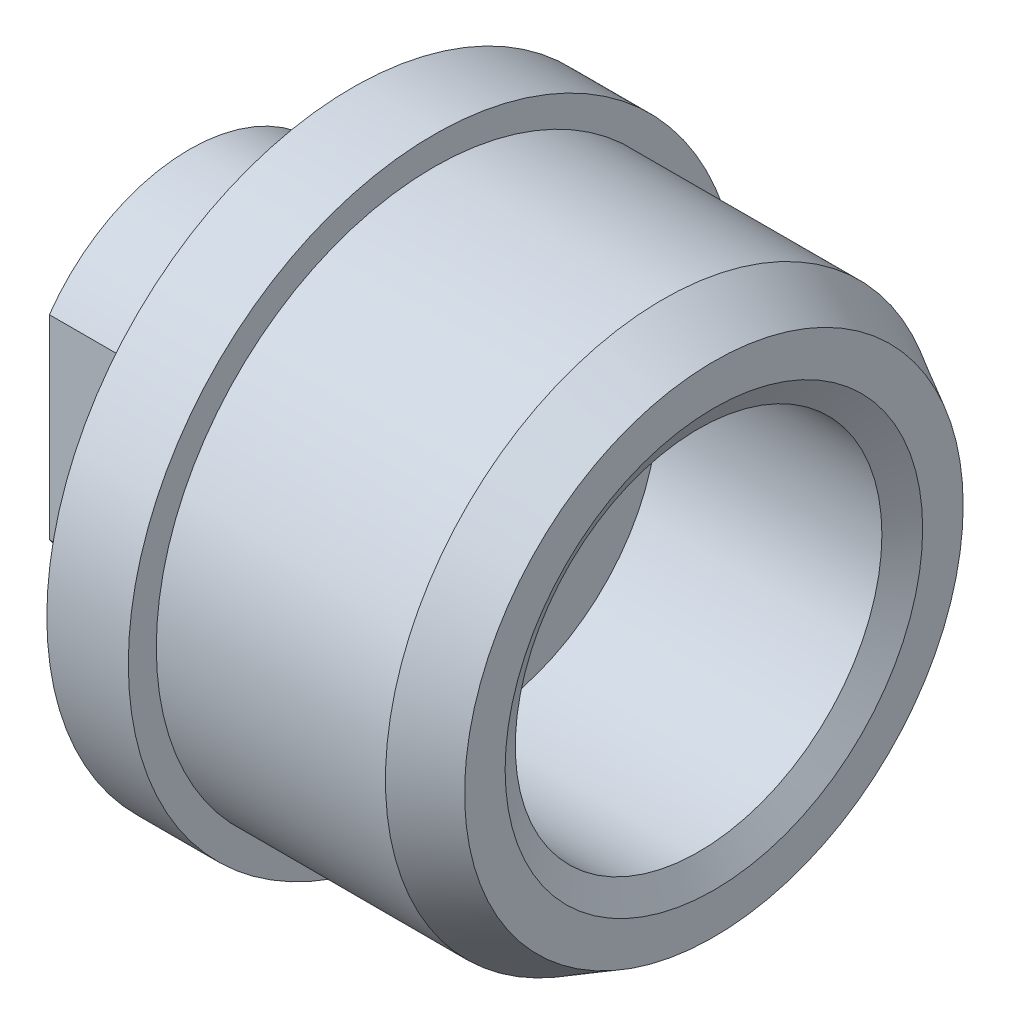
from build123d import *

# Parameters (mm, degrees)
SKETCH1_R           = 6.9215
BOSS_EXTRUDE1_DEPTH = 6.985
SKETCH2_R           = 7.62
BOSS_EXTRUDE2_DEPTH = 2.032
SKETCH3_R           = 4.2545
BOSS_EXTRUDE3_DEPTH = 4.064
CUT_EXTRUDE1_START  = -4.064
CUT_EXTRUDE1_DEPTH  = 4.064
SKETCH5_R           = 2.032
CUT_EXTRUDE2_DEPTH  = 17.948196394
SKETCH6_R           = 4.572
CUT_EXTRUDE3_DEPTH  = 5.969
CHAMFER1_SIZE       = 1.27
CHAMFER1_SIZE2      = 0.703972495
CHAMFER2_SIZE       = 0.635
CHAMFER2_SIZE2      = 0.381546493


with BuildPart() as part:
    # Sketch1 → Boss-Extrude1 (new body)
    with BuildSketch(Plane(origin=(0, 0, 0), x_dir=(0, 0, -1), z_dir=(1, 0, 0))):
        Circle(SKETCH1_R)
    extrude(amount=-BOSS_EXTRUDE1_DEPTH)

    # Sketch2 → Boss-Extrude2 (add)
    with BuildSketch(Plane.ZY.offset(6.985)):
        Circle(SKETCH2_R)
    extrude(amount=BOSS_EXTRUDE2_DEPTH)

    # Sketch3 → Boss-Extrude3 (add)
    with BuildSketch(Plane.ZY.offset(9.017)):
        Circle(SKETCH3_R)
    extrude(amount=BOSS_EXTRUDE3_DEPTH)

    # Sketch4 → Cut-Extrude1 (cut)
    with BuildSketch(Plane.ZY.offset(13.081).offset(CUT_EXTRUDE1_START)):
        with BuildLine():
            Line((-3.4925, -2.429653062), (-3.4925, 2.429653062))
            ThreePointArc((-3.4925, 2.429653062), (-4.2545, 0), (-3.4925, -2.429653062))
        make_face()
        with BuildLine():
            ThreePointArc((4.2545, 0), (4.059532701, 1.273171041), (3.4925, 2.429653062))
            Line((3.4925, 2.429653062), (3.4925, -2.429653062))
            ThreePointArc((3.4925, -2.429653062), (4.059532701, -1.273171041), (4.2545, 0))
        make_face()
    extrude(amount=CUT_EXTRUDE1_DEPTH, mode=Mode.SUBTRACT)

    # Sketch5 → Cut-Extrude2 (cut, through all)
    with BuildSketch(Plane.ZY.offset(13.081)):
        Circle(SKETCH5_R)
    extrude(amount=-CUT_EXTRUDE2_DEPTH, mode=Mode.SUBTRACT)

    # Sketch6 → Cut-Extrude3 (cut)
    with BuildSketch(Plane(origin=(0, 0, 0), x_dir=(0, 0, -1), z_dir=(1, 0, 0))):
        Circle(SKETCH6_R)
    extrude(amount=-CUT_EXTRUDE3_DEPTH, mode=Mode.SUBTRACT)

    # Chamfer1
    chamfer1_edges = [part.edges().sort_by_distance(p)[0] for p in [
        (0, 0, 6.9215),
    ]]
    chamfer1_side = [part.faces().sort_by_distance(p)[0] for p in [
        (-3.4925, 0, 6.9215),
    ]]
    chamfer(chamfer1_edges, length=CHAMFER1_SIZE, length2=CHAMFER1_SIZE2, reference=chamfer1_side[0])

    # Chamfer2
    chamfer2_edges = [part.edges().sort_by_distance(p)[0] for p in [
        (0, 0, 4.572),
    ]]
    chamfer2_side = [part.faces().sort_by_distance(p)[0] for p in [
        (0, 0, 6.04166927),
    ]]
    chamfer(chamfer2_edges, length=CHAMFER2_SIZE, length2=CHAMFER2_SIZE2, reference=chamfer2_side[0])


solid = part.part
